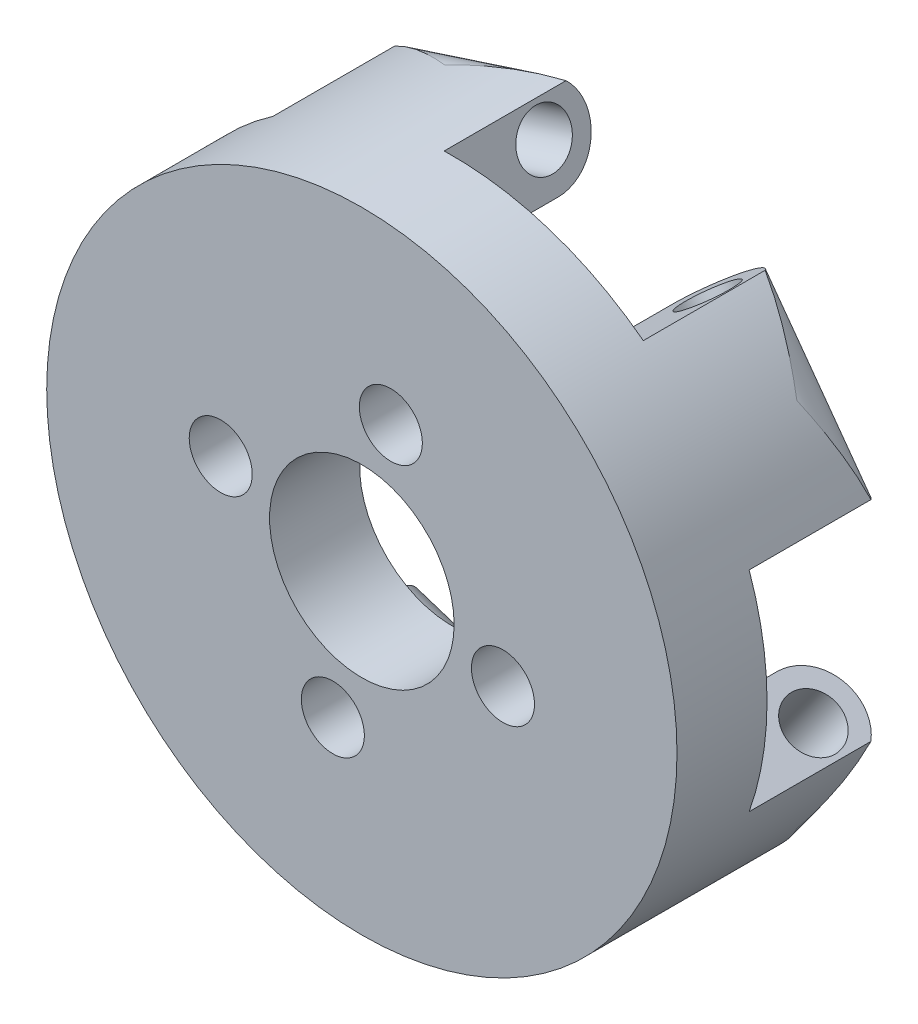
from build123d import *
from build123d.topology import SkipClean

# Parameters (mm, degrees)
ESQUISSE1_R                  = 17.5
ESQUISSE1_R_2                = 5.125
BOSS_EXTRU_1_DEPTH           = 5
ESQUISSE2_R                  = 1.5
BOSS_EXTRU_2_DEPTH           = 5
ENL_V_MAT_EXTRU_1_DEPTH      = 26.860201082
R_P_TITION_CIRCULAIRE1_COUNT = 5
ESQUISSE4_R                  = 1.75
ENL_V_MAT_EXTRU_2_DEPTH      = 10


with BuildPart() as part:
    # Esquisse1 → Boss.-Extru.1 (new body)
    with BuildSketch(Plane.XY):
        Circle(ESQUISSE1_R)
        Circle(ESQUISSE1_R_2, mode=Mode.SUBTRACT)
    extrude(amount=BOSS_EXTRU_1_DEPTH)

    # Esquisse2 → Boss.-Extru.2 (add, symmetric)
    with BuildSketch(Plane(origin=(0, 0, 0), x_dir=(1, 0, 0), z_dir=(0, 1, 0))):
        with BuildLine():
            Line((-17.5, 0), (-17.5, 5))
            ThreePointArc((-17.5, 5), (-15, 7.5), (-12.5, 5))
            Line((-12.5, 5), (-12.5, 0))
            Line((-12.5, 0), (-17.5, 0))
        make_face()
        with Locations((-15, 5)):
            Circle(ESQUISSE2_R, mode=Mode.SUBTRACT)
    boss_extru_2 = extrude(amount=BOSS_EXTRU_2_DEPTH, both=True)

    # Esquisse3 → Enlèv. mat.-Extru.1 (cut, through all)
    with SkipClean():  # the faces are left unmerged after this step: merging them gives an invalid solid
        with BuildSketch(Plane.XY):
            with BuildLine():
                ThreePointArc((-16.770509831, -5), (-17.316667145, -2.526467688), (-17.5, 0))
                Line((-17.5, 0), (-17.5, -5))
                Line((-17.5, -5), (-16.770509831, -5))
            make_face()
            with BuildLine():
                Line((-17.5, 5), (-17.5, 0))
                ThreePointArc((-17.5, 0), (-17.316667145, 2.526467688), (-16.770509831, 5))
                Line((-16.770509831, 5), (-17.5, 5))
            make_face()
        enl_v_mat_extru_1 = extrude(amount=-ENL_V_MAT_EXTRU_1_DEPTH, mode=Mode.SUBTRACT)

    # Répétition circulaire1: Boss.-Extru.2, Enlèv. mat.-Extru.1 ×5 about axis
    with SkipClean():  # the faces are left unmerged after this step: merging them gives an invalid solid
        r_p_tition_circulaire1_axis = Axis((0, 0, 0), (0, 0, 1))
        add([boss_extru_2.rotate(r_p_tition_circulaire1_axis, i * 360 / R_P_TITION_CIRCULAIRE1_COUNT) for i in range(1, R_P_TITION_CIRCULAIRE1_COUNT)])
        add([enl_v_mat_extru_1.rotate(r_p_tition_circulaire1_axis, i * 360 / R_P_TITION_CIRCULAIRE1_COUNT) for i in range(1, R_P_TITION_CIRCULAIRE1_COUNT)], mode=Mode.SUBTRACT)

    # Esquisse4 → Enlèv. mat.-Extru.2 (cut)
    with SkipClean():  # the faces are left unmerged after this step: merging them gives an invalid solid
        with BuildSketch(Plane(origin=(0, 0, 0), x_dir=(-1, 0, 0), z_dir=(0, 0, -1))):
            with Locations((-7.836351046, -1.609845421)):
                Circle(ESQUISSE4_R)
            with Locations((1.609845421, -7.836351046)):
                Circle(ESQUISSE4_R)
            with Locations((7.836351046, 1.609845421)):
                Circle(ESQUISSE4_R)
            with Locations((-1.609845421, 7.836351046)):
                Circle(ESQUISSE4_R)
        extrude(amount=-ENL_V_MAT_EXTRU_2_DEPTH, mode=Mode.SUBTRACT)


solid = part.part
